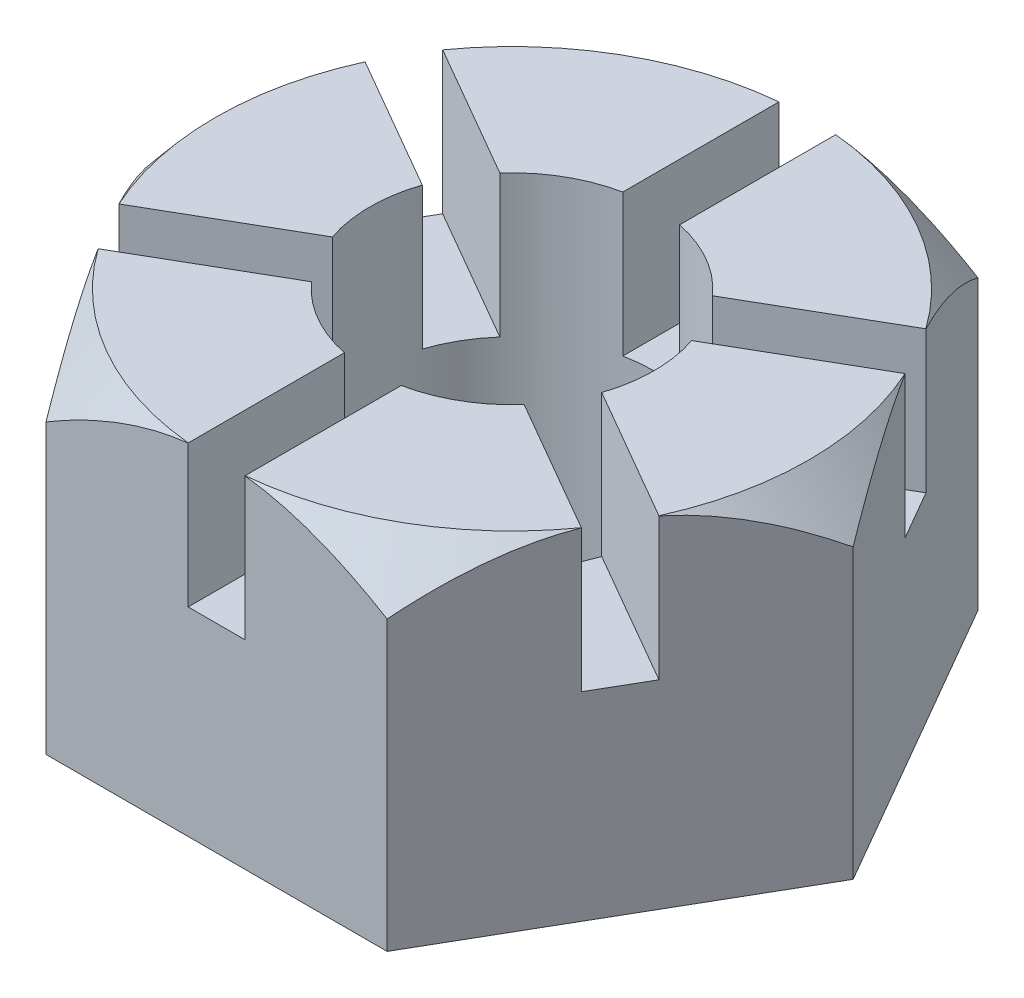
from build123d import *

# Parameters (mm, degrees)
BOSS_EXTRUDE1_DEPTH = 60
CUT_EXTRUDE9_DEPTH  = 25
SKETCH5_OUTSIDE_W   = 324.786
SKETCH5_OUTSIDE_H   = 308.698
SKETCH5_OUTSIDE_R   = 52.224812322
CUT_EXTRUDE10_DEPTH = 100.545634426
CUT_EXTRUDE10_DRAFT = -40
SKETCH6_R           = 25
CUT_EXTRUDE11_DEPTH = 100.545634426


with BuildPart() as part:
    # Sketch1 → Boss-Extrude1 (new body)
    with BuildSketch(Plane(origin=(0, 0, 0), x_dir=(1, 0, 0), z_dir=(0, 1, 0))):
        Polygon((30.022213998, -52), (60.044427996, 0), (30.022213998, 52), (-30.022213998, 52), (-60.044427996, 0), (-30.022213998, -52), align=None)
    extrude(amount=BOSS_EXTRUDE1_DEPTH)

    # Sketch2 → Cut-Extrude9 (cut)
    with BuildSketch(Plane(origin=(0, 60, 0), x_dir=(1, 0, 0), z_dir=(0, 1, 0))):
        with BuildLine():
            Line((5, 52), (-5, 52))
            Line((-5, 52), (-5, 24.494897428))
            ThreePointArc((-5, 24.494897428), (0, 25), (5, 24.494897428))
            Line((5, 24.494897428), (5, 52))
        make_face()
        with BuildLine():
            ThreePointArc((5, -24.494897428), (0, -25), (-5, -24.494897428))
            Line((-5, -24.494897428), (-5, -52))
            Line((-5, -52), (5, -52))
            Line((5, -52), (5, -24.494897428))
        make_face()
        with BuildLine():
            Line((42.533320997, 30.330127019), (18.713203436, 16.577575733))
            ThreePointArc((18.713203436, 16.577575733), (21.650635095, 12.5), (23.713203436, 7.917321695))
            Line((23.713203436, 7.917321695), (47.533320997, 21.669872981))
            Line((47.533320997, 21.669872981), (42.533320997, 30.330127019))
        make_face()
        with BuildLine():
            ThreePointArc((-23.713203436, 7.917321695), (-21.650635095, 12.5), (-18.713203436, 16.577575733))
            Line((-18.713203436, 16.577575733), (-42.533320997, 30.330127019))
            Line((-42.533320997, 30.330127019), (-47.533320997, 21.669872981))
            Line((-47.533320997, 21.669872981), (-23.713203436, 7.917321695))
        make_face()
        with BuildLine():
            ThreePointArc((-18.713203436, -16.577575733), (-21.650635095, -12.5), (-23.713203436, -7.917321695))
            Line((-23.713203436, -7.917321695), (-47.533320997, -21.669872981))
            Line((-47.533320997, -21.669872981), (-42.533320997, -30.330127019))
            Line((-42.533320997, -30.330127019), (-18.713203436, -16.577575733))
        make_face()
        with BuildLine():
            Line((47.533320997, -21.669872981), (23.713203436, -7.917321695))
            ThreePointArc((23.713203436, -7.917321695), (21.650635095, -12.5), (18.713203436, -16.577575733))
            Line((18.713203436, -16.577575733), (42.533320997, -30.330127019))
            Line((42.533320997, -30.330127019), (47.533320997, -21.669872981))
        make_face()
    extrude(amount=-CUT_EXTRUDE9_DEPTH, mode=Mode.SUBTRACT)


with BuildPart() as cut_extrude10_tool:
    # Sketch5 outside → Cut-Extrude10 (with draft: the straight prism first)
    with BuildSketch(Plane(origin=(0, 60, 0), x_dir=(1, 0, 0), z_dir=(0, 1, 0))):
        Rectangle(SKETCH5_OUTSIDE_W, SKETCH5_OUTSIDE_H)
        Circle(SKETCH5_OUTSIDE_R, mode=Mode.SUBTRACT)
    extrude(amount=-CUT_EXTRUDE10_DEPTH)
    # Cut-Extrude10: the draft: its side faces are tilted about the plane it starts from
    cut_extrude10_sides = [cut_extrude10_tool.faces().sort_by_distance(p)[0] for p in [
        (0, 9.727182787, 154.349),
        (162.393, 9.727182787, 0),
        (0, 9.727182787, -154.349),
        (-162.393, 9.727182787, 0),
        (-52.224812322, 9.727182787, 0),
    ]]
    draft(cut_extrude10_sides, Plane(origin=(0, 60, 0), x_dir=(1, 0, 0), z_dir=(0, 1, 0)), CUT_EXTRUDE10_DRAFT)


with BuildPart() as part_1:
    add(part.part)

    # Cut-Extrude10: cut by cut_extrude10_tool
    add(cut_extrude10_tool.part, mode=Mode.SUBTRACT)

    # Sketch6 → Cut-Extrude11 (cut, through all)
    with BuildSketch(Plane(origin=(0, 60, 0), x_dir=(1, 0, 0), z_dir=(0, 1, 0))):
        with Locations(Location((0, 0, 0), (0, 0, 270))):
            Circle(SKETCH6_R)
    extrude(amount=-CUT_EXTRUDE11_DEPTH, mode=Mode.SUBTRACT)


solid = part_1.part
